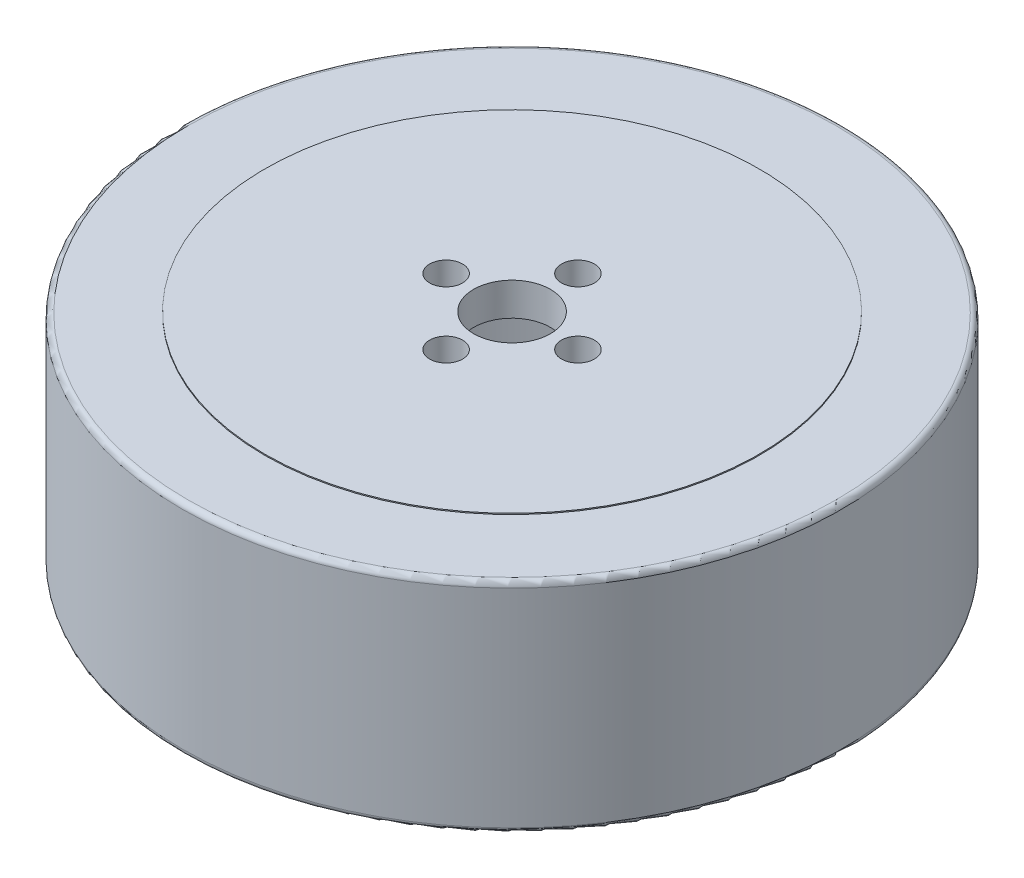
from build123d import *

# Parameters (mm, degrees)
SKETCH_1_R          = 30
SKETCH_1_R_2        = 1.5
SKETCH_1_R_3        = 3.5
EXTRUDE_1_DEPTH     = 20
SKETCH_2_R          = 21
CUT_EXTRUDE_1_DEPTH = 17
CUT_EXTRUDE_START   = -0.1
SKETCH_3_R          = 30
SKETCH_3_R_2        = 22.5
CUT_EXTRUDE_2_DEPTH = 0.1
FILLET_1_R          = 0.5


with BuildPart() as part:
    # 草图1 → 凸台-拉伸1 (new body)
    with BuildSketch(Plane(origin=(0, 0, 0), x_dir=(1, 0, 0), z_dir=(0, 1, 0))):
        with Locations(Location((0, 0, 0), (0, 0, 270))):
            Circle(SKETCH_1_R)
        with Locations(Location((0, 6, 0), (0, 0, 270))):
            Circle(SKETCH_1_R_2, mode=Mode.SUBTRACT)
        with Locations(Location((0, 0, 0), (0, 0, 270))):
            Circle(SKETCH_1_R_3, mode=Mode.SUBTRACT)
        with Locations(Location((6, 0, 0), (0, 0, 270))):
            Circle(SKETCH_1_R_2, mode=Mode.SUBTRACT)
        with Locations(Location((0, -6, 0), (0, 0, 270))):
            Circle(SKETCH_1_R_2, mode=Mode.SUBTRACT)
        with Locations(Location((-6, 0, 0), (0, 0, 270))):
            Circle(SKETCH_1_R_2, mode=Mode.SUBTRACT)
    extrude(amount=EXTRUDE_1_DEPTH)

    # 草图2 → 切除-拉伸1 (cut)
    with BuildSketch(Plane(origin=(0, 0, 0), x_dir=(-1, 0, 0), z_dir=(0, -1, 0))):
        with Locations(Location((0, 0, 0), (0, 0, 90))):
            Circle(SKETCH_2_R)
    extrude(amount=-CUT_EXTRUDE_1_DEPTH, mode=Mode.SUBTRACT)

    # 草图3 → 切除-拉伸2 (cut)
    with BuildSketch(Plane(origin=(0, 20, 0), x_dir=(1, 0, 0), z_dir=(0, 1, 0)).offset(CUT_EXTRUDE_START)):
        with Locations(Location((0, 0, 0), (0, 0, 270))):
            Circle(SKETCH_3_R)
        with Locations(Location((0, 0, 0), (0, 0, 270))):
            Circle(SKETCH_3_R_2, mode=Mode.SUBTRACT)
    extrude(amount=CUT_EXTRUDE_2_DEPTH, mode=Mode.SUBTRACT)

    # 圆角1
    fillet_1_edges = [part.edges().sort_by_distance(p)[0] for p in [
        (0, 0, -30),
        (0, 19.9, -30),
    ]]
    fillet(fillet_1_edges, radius=FILLET_1_R)


solid = part.part
